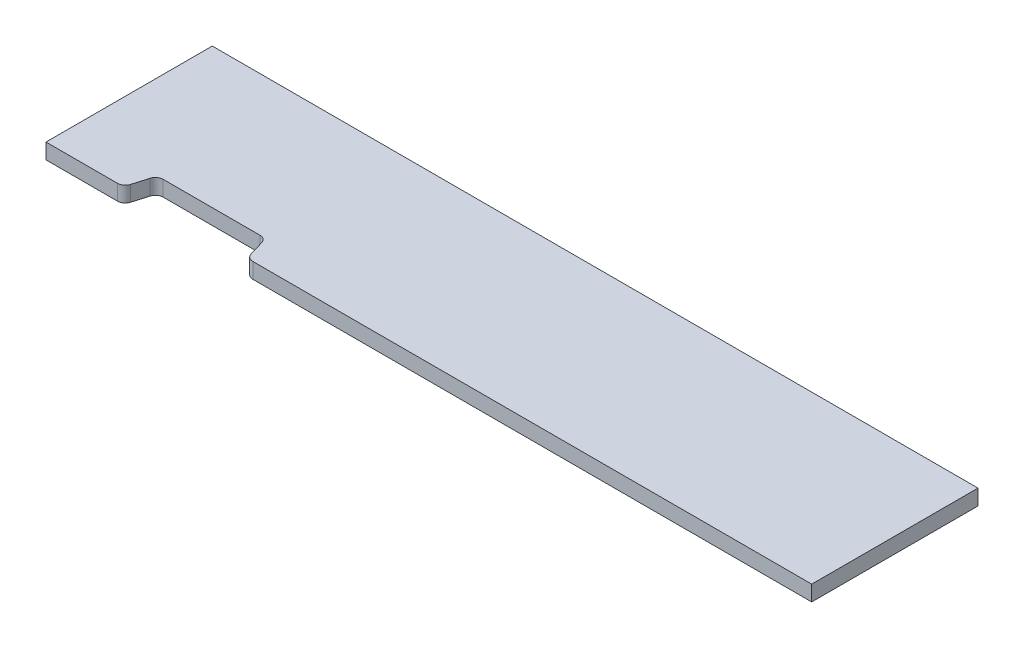
from build123d import *

# Parameters (mm, degrees)
SKETCH1_W           = 628.65
SKETCH1_H           = 136.525
BOSS_EXTRUDE1_DEPTH = 12.7
CUT_EXTRUDE1_DEPTH  = 322.902569936
FILLET1_R           = 6.35


with BuildPart() as part:
    # Sketch1 → Boss-Extrude1 (new body)
    with BuildSketch(Plane(origin=(0, 0, 0), x_dir=(1, 0, 0), z_dir=(0, 1, 0))):
        Rectangle(SKETCH1_W, SKETCH1_H)
    extrude(amount=-BOSS_EXTRUDE1_DEPTH)

    # Sketch2 → Cut-Extrude1 (cut, through all)
    with BuildSketch(Plane(origin=(0, 0, 0), x_dir=(1, 0, 0), z_dir=(0, 1, 0))):
        Polygon((-250.825, -68.2625), (-244.475, -46.6725), (-155.575, -46.6725), (-149.225, -68.2625), align=None)
    extrude(amount=-CUT_EXTRUDE1_DEPTH, mode=Mode.SUBTRACT)

    # Fillet1
    fillet1_edges = [part.edges().sort_by_distance(p)[0] for p in [
        (-149.225, -6.35, 68.2625),
        (-250.825, -6.35, 68.2625),
        (-244.475, -6.35, 46.6725),
        (-155.575, -6.35, 46.6725),
    ]]
    fillet(fillet1_edges, radius=FILLET1_R)


solid = part.part
